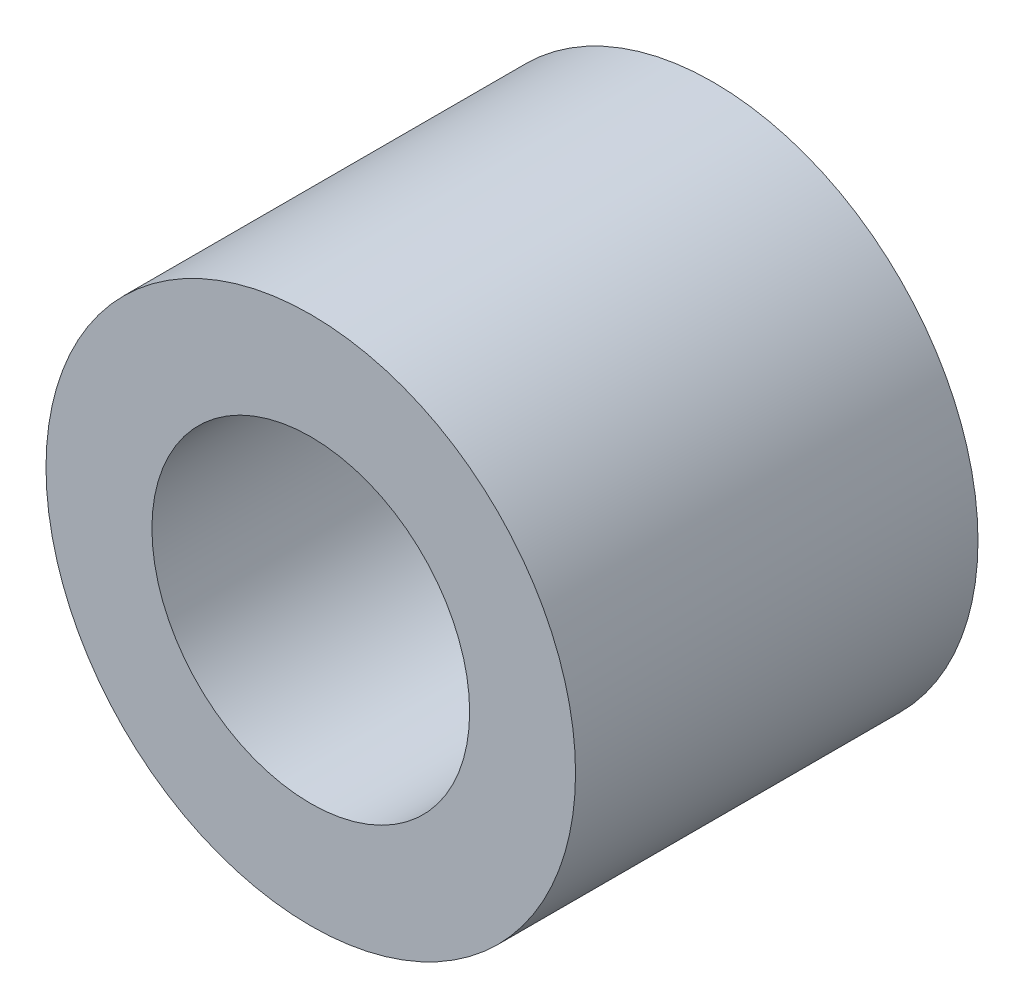
from build123d import *

# Parameters (mm, degrees)
SKETCH1_R           = 2.5
SKETCH1_R_2         = 1.5
BOSS_EXTRUDE1_DEPTH = 3.8


with BuildPart() as part:
    # Sketch1 → Boss-Extrude1 (new body)
    with BuildSketch(Plane.XY):
        with Locations(Location((0, 0, 0), (0, 0, 180))):
            Circle(SKETCH1_R)
        with Locations(Location((0, 0, 0), (0, 0, 180))):
            Circle(SKETCH1_R_2, mode=Mode.SUBTRACT)
    extrude(amount=BOSS_EXTRUDE1_DEPTH)


solid = part.part
